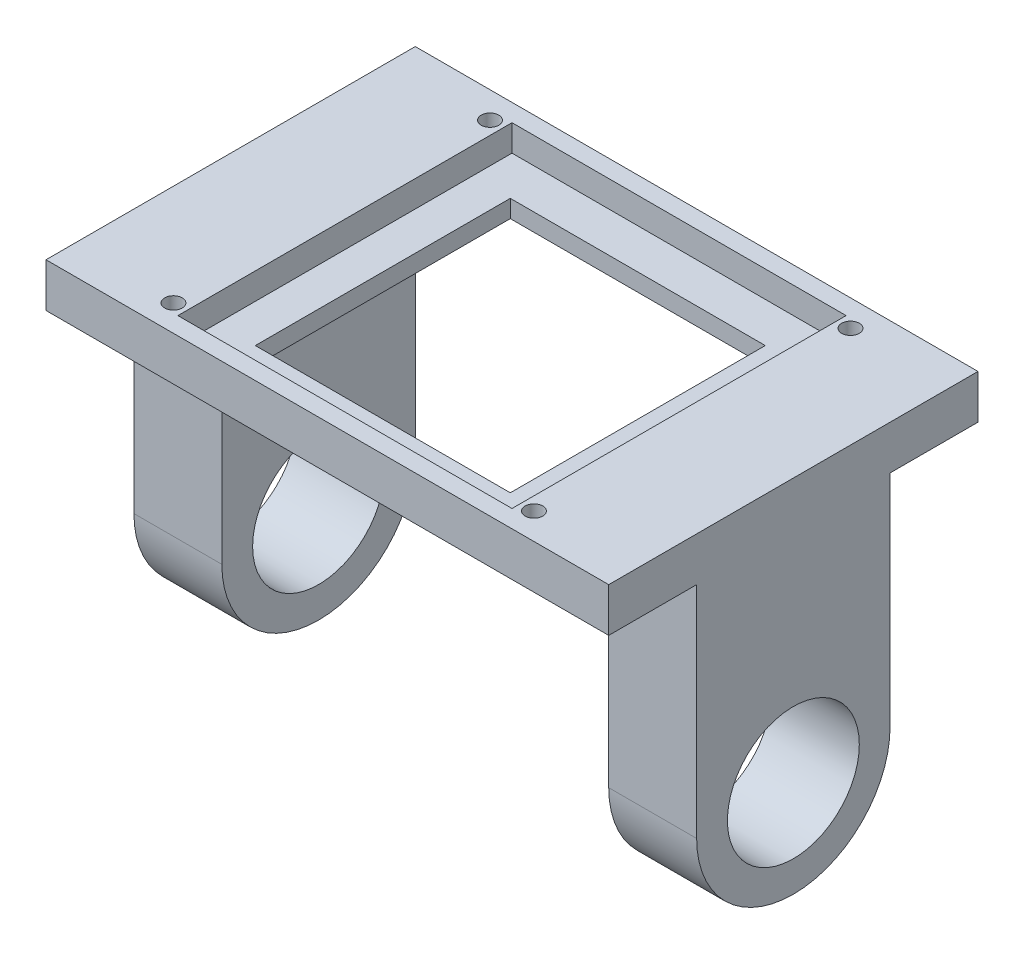
from build123d import *

# Parameters (mm, degrees)
SKETCH1_R            = 11
SKETCH1_R_2          = 7.5
EXTRUDE_THIN1_DEPTH  = 10
BOSS_EXTRUDE2_DEPTH  = 10
SKETCH6_W            = 10
SKETCH6_H            = 5
BOSS_EXTRUDE3_DEPTH  = 10
SKETCH8_W            = 10
SKETCH8_H            = 5
BOSS_EXTRUDE4_DEPTH  = 10
SKETCH9_W            = 42
SKETCH9_H            = 5
BOSS_EXTRUDE5_DEPTH  = 54
LPATTERN3_COUNT      = 2
LPATTERN3_PITCH      = 54
SKETCH15_R           = 11
BOSS_EXTRUDE6_DEPTH  = 10
SKETCH17_R           = 7.5
CUT_EXTRUDE1_DEPTH   = 10
SKETCH19_W           = 38
SKETCH19_H           = 38
CUT_EXTRUDE3_DEPTH   = 3
SKETCH25_W           = 29
SKETCH25_H           = 29
CUT_EXTRUDE4_DEPTH   = 2
SKETCH26_R           = 1.00264766
CUT_EXTRUDE5_DEPTH   = 3
LPATTERN4_COUNT      = 2
LPATTERN4_PITCH      = 36
LPATTERN4_COUNT_DIR2 = 2
LPATTERN4_PITCH_DIR2 = 41


with BuildPart() as part:
    # Sketch1 → Extrude-Thin1 (new body)
    with BuildSketch(Plane(origin=(0, 0, 0), x_dir=(0, 0, -1), z_dir=(1, 0, 0))):
        Circle(SKETCH1_R)
        Circle(SKETCH1_R_2, mode=Mode.SUBTRACT)
    extrude(amount=EXTRUDE_THIN1_DEPTH)

    # Sketch3 → Boss-Extrude2 (add)
    with BuildSketch(Plane(origin=(0, 0, 0), x_dir=(0, 0, -1), z_dir=(1, 0, 0))):
        with BuildLine():
            Line((-11, 0), (-11, 30))
            Line((-11, 30), (11, 30))
            Line((11, 30), (11, 0))
            ThreePointArc((11, 0), (0, 11), (-11, 0))
        make_face()
    boss_extrude2 = extrude(amount=BOSS_EXTRUDE2_DEPTH)

    # Sketch6 → Boss-Extrude3 (add)
    with BuildSketch(Plane.XY.offset(11)):
        with Locations((5, 27.5)):
            Rectangle(SKETCH6_W, SKETCH6_H)
    extrude(amount=BOSS_EXTRUDE3_DEPTH)

    # Sketch8 → Boss-Extrude4 (add)
    with BuildSketch(Plane(origin=(0, 0, -11), x_dir=(-1, 0, 0), z_dir=(0, 0, -1))):
        with Locations((-5, 27.5)):
            Rectangle(SKETCH8_W, SKETCH8_H)
    extrude(amount=BOSS_EXTRUDE4_DEPTH)

    # Sketch9 → Boss-Extrude5 (add)
    with BuildSketch(Plane.ZY):
        with Locations((0, 27.5)):
            Rectangle(SKETCH9_W, SKETCH9_H)
    extrude(amount=BOSS_EXTRUDE5_DEPTH)

    # LPattern3: Boss-Extrude2 ×2
    with Locations(*[(-i * LPATTERN3_PITCH, 0, 0) for i in range(1, LPATTERN3_COUNT)]):
        add(boss_extrude2)

    # Sketch15 → Boss-Extrude6 (add)
    with BuildSketch(Plane.ZY.offset(54)):
        Circle(SKETCH15_R)
    extrude(amount=-BOSS_EXTRUDE6_DEPTH)

    # Sketch17 → Cut-Extrude1 (cut)
    with BuildSketch(Plane.ZY.offset(54)):
        with Locations(Location((0, 0, 0), (0, 0, 180))):
            Circle(SKETCH17_R)
    extrude(amount=-CUT_EXTRUDE1_DEPTH, mode=Mode.SUBTRACT)

    # Sketch19 → Cut-Extrude3 (cut)
    with BuildSketch(Plane(origin=(0, 30, 0), x_dir=(1, 0, 0), z_dir=(0, 1, 0))):
        with Locations((-22, 0)):
            Rectangle(SKETCH19_W, SKETCH19_H)
    extrude(amount=-CUT_EXTRUDE3_DEPTH, mode=Mode.SUBTRACT)

    # Sketch25 → Cut-Extrude4 (cut)
    with BuildSketch(Plane(origin=(0, 27, 0), x_dir=(1, 0, 0), z_dir=(0, 1, 0))):
        with Locations((-22.144950272, -0.049169749)):
            Rectangle(SKETCH25_W, SKETCH25_H)
    extrude(amount=-CUT_EXTRUDE4_DEPTH, mode=Mode.SUBTRACT)

    # Sketch26 → Cut-Extrude5 (cut)
    with BuildSketch(Plane(origin=(0, 30, 0), x_dir=(1, 0, 0), z_dir=(0, 1, 0))):
        with Locations(Location((-1.5, 17.99735234, 0), (0, 0, 270))):
            Circle(SKETCH26_R)
    cut_extrude5 = extrude(amount=-CUT_EXTRUDE5_DEPTH, mode=Mode.SUBTRACT)

    # LPattern4: Cut-Extrude5 2 × 2
    with Locations(*[(-j * LPATTERN4_PITCH_DIR2, 0, i * LPATTERN4_PITCH) for i in range(LPATTERN4_COUNT) for j in range(LPATTERN4_COUNT_DIR2) if (i, j) != (0, 0)]):
        add(cut_extrude5, mode=Mode.SUBTRACT)


solid = part.part
